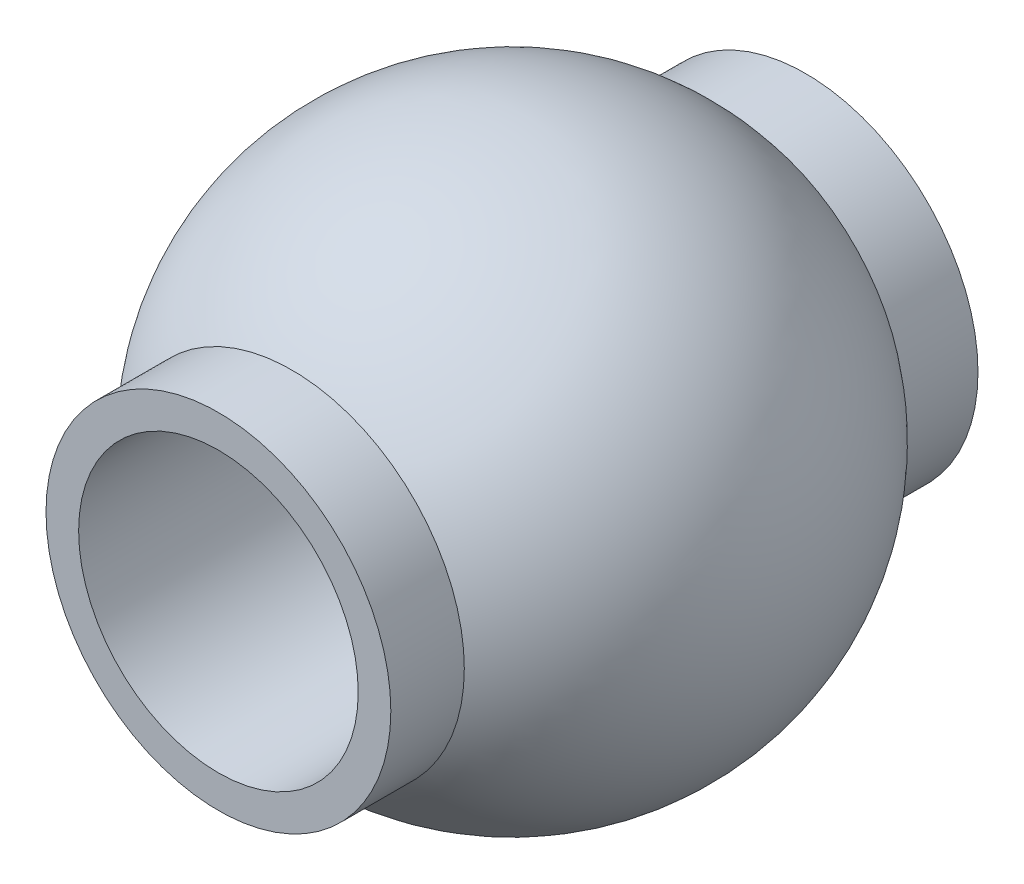
from build123d import *

# Parameters (mm, degrees)
SKETCH_2_R          = 1.85
SKETCH_2_R_2        = 1.5
EXTRUDE_1_DEPTH     = 3.15
CUT_EXTRUDE_START   = -6.3
SKETCH_3_R          = 1.5
CUT_EXTRUDE_1_DEPTH = 6.3


with BuildPart() as part:
    # 草图1 → 旋转1 (revolve)
    with BuildSketch(Plane.XY):
        with BuildLine():
            Line((0, -3), (0, 3))
            ThreePointArc((0, 3), (3, 0), (0, -3))
        make_face()
    revolve(axis=Axis((0, -3, 0), (0, 1, 0)))

    # 草图2 → 凸台-拉伸1 (add, symmetric)
    with BuildSketch(Plane.XY):
        with Locations(Location((0, 0, 0), (0, 0, 180))):
            Circle(SKETCH_2_R)
        with Locations(Location((0, 0, 0), (0, 0, 180))):
            Circle(SKETCH_2_R_2, mode=Mode.SUBTRACT)
    extrude(amount=EXTRUDE_1_DEPTH, both=True)

    # 草图3 → 切除-拉伸1 (cut)
    with BuildSketch(Plane.XY.offset(3.15).offset(CUT_EXTRUDE_START)):
        Circle(SKETCH_3_R)
    extrude(amount=CUT_EXTRUDE_1_DEPTH, mode=Mode.SUBTRACT)


solid = part.part
